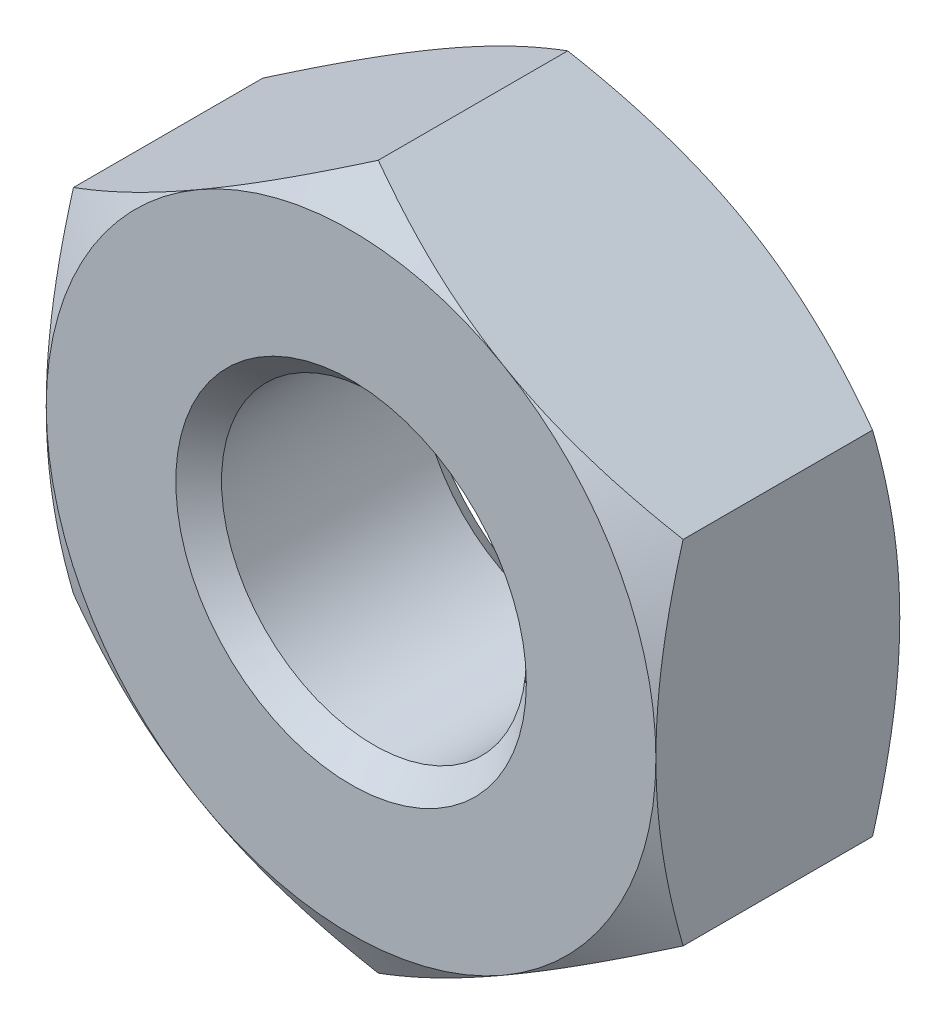
from build123d import *

# Parameters (mm, degrees)
SKETCH1_R           = 3
SKETCH1_R_2         = 1
BOSS_EXTRUDE1_DEPTH = 1.6
CHAMFER1_SIZE       = 1
CHAMFER1_SIZE2      = 0.577350269
CHAMFER2_SIZE       = 1
CHAMFER2_SIZE2      = 0.577350269
SKETCH1_3_R         = 3
CUT_EXTRUDE1_DEPTH  = 5.53431362
CHAMFER3_SIZE       = 0.15


with BuildPart() as part:
    # Sketch1 → Boss-Extrude1 (new body)
    with BuildSketch(Plane.XY):
        Circle(SKETCH1_R)
        Circle(SKETCH1_R_2, mode=Mode.SUBTRACT)
    extrude(amount=BOSS_EXTRUDE1_DEPTH)

    # Chamfer1
    chamfer1_edges = [part.edges().sort_by_distance(p)[0] for p in [
        (-3, 0, 1.6),
    ]]
    chamfer1_side = [part.faces().sort_by_distance(p)[0] for p in [
        (-2.915147186, 0, 1.6),
    ]]
    chamfer(chamfer1_edges, length=CHAMFER1_SIZE, length2=CHAMFER1_SIZE2, reference=chamfer1_side[0])

    # Chamfer2
    chamfer2_edges = [part.edges().sort_by_distance(p)[0] for p in [
        (-3, 0, 0),
    ]]
    chamfer2_side = [part.faces().sort_by_distance(p)[0] for p in [
        (-2.915147186, 0, 0),
    ]]
    chamfer(chamfer2_edges, length=CHAMFER2_SIZE, length2=CHAMFER2_SIZE2, reference=chamfer2_side[0])

    # Sketch1<3> → Cut-Extrude1 (cut, through all)
    with BuildSketch(Plane.XY):
        Circle(SKETCH1_3_R)
        Polygon((-2, 1.154700538), (0, 2.309401077), (2, 1.154700538), (2, -1.154700538), (0, -2.309401077), (-2, -1.154700538), align=None, mode=Mode.SUBTRACT)
    extrude(amount=CUT_EXTRUDE1_DEPTH, mode=Mode.SUBTRACT)

    # Chamfer3
    chamfer3_edges = [part.edges().sort_by_distance(p)[0] for p in [
        (-1, 0, 0),
        (-1, 0, 1.6),
    ]]
    chamfer(chamfer3_edges, length=CHAMFER3_SIZE)


solid = part.part
